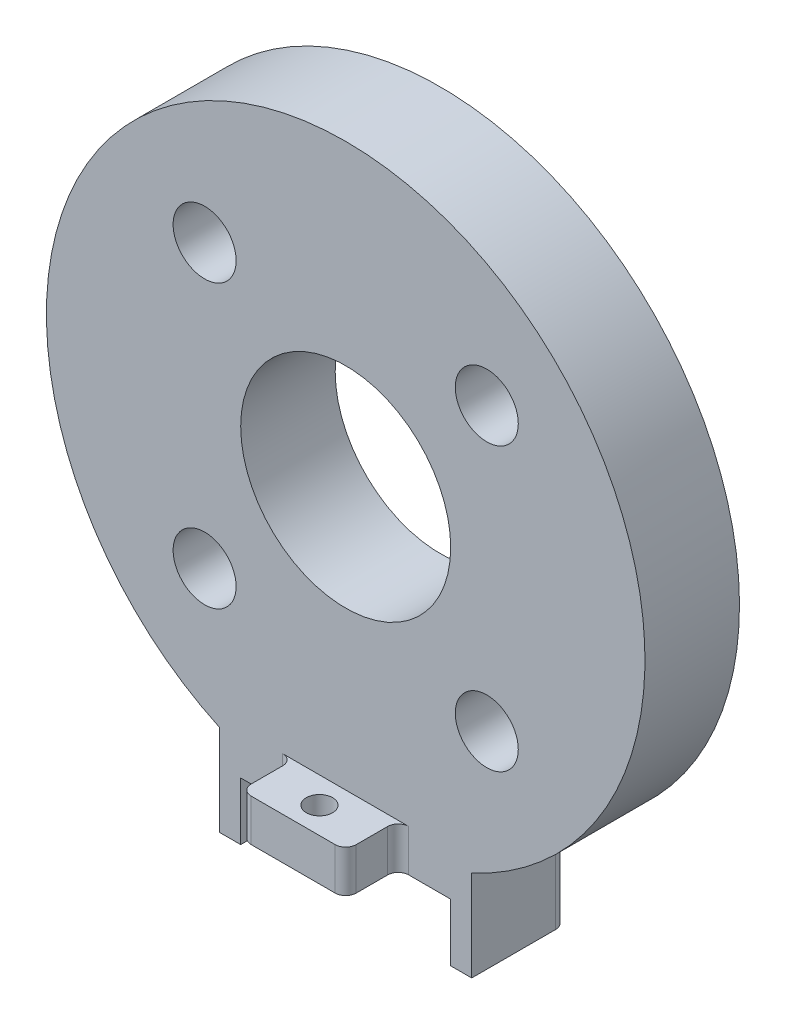
from build123d import *

# Parameters (mm, degrees)
EXTRUDE_1_DEPTH              = 9
SKETCH_2_W                   = 20
SKETCH_2_H                   = 8
CUT_EXTRUDE_1_DEPTH          = 5.5
SKETCH_3_W                   = 10
SKETCH_3_H                   = 4
EXTRUDE_2_DEPTH              = 5
HOLE_WIZARD_20_0_20_1_D      = 20
HOLE_WIZARD_20_0_20_1_DEPTH  = 14
HOLE_WIZARD_2_5_2_5_1_D      = 2.5
HOLE_WIZARD_2_5_2_5_1_DEPTH  = 57.5
HOLE_WIZARD_2_5_2_5_2_D      = 2.5
HOLE_WIZARD_2_5_2_5_2_DEPTH  = 4
HOLE_WIZARD_M3_1_D           = 3.2
HOLE_WIZARD_M3_1_CBORE_D     = 6
HOLE_WIZARD_M3_1_CBORE_DEPTH = 5
FILLET_1_R                   = 0.5
FILLET_2_R                   = 1


with BuildPart() as part:
    # 草图1 → 凸台-拉伸1 (new body)
    with BuildSketch(Plane(origin=(0, 0, 0), x_dir=(-1, 0, 0), z_dir=(0, 0, -1))):
        with BuildLine():
            Line((-12, -25.850531909), (-12, -34.5))
            Line((-12, -34.5), (12, -34.5))
            Line((12, -34.5), (12, -25.850531909))
            ThreePointArc((12, -25.850531909), (0, 28.5), (-12, -25.850531909))
        make_face()
    extrude(amount=-EXTRUDE_1_DEPTH)

    # 草图2 → 切除-拉伸1 (cut)
    with BuildSketch(Plane.XZ.offset(34.5)):
        with Locations((0, 5)):
            Rectangle(SKETCH_2_W, SKETCH_2_H)
    extrude(amount=-CUT_EXTRUDE_1_DEPTH, mode=Mode.SUBTRACT)

    # 草图3 → 凸台-拉伸2 (add)
    with BuildSketch(Plane.XY.offset(9)):
        with Locations((0, -27)):
            Rectangle(SKETCH_3_W, SKETCH_3_H)
    extrude(amount=EXTRUDE_2_DEPTH)

    # Ø20.0 (20) 直径孔1
    with Locations(Plane(origin=(0, 0, 0), x_dir=(-1, 0, 0), z_dir=(0, 0, -1))):
        with Locations((0, 0)):
            Hole(HOLE_WIZARD_20_0_20_1_D / 2, depth=HOLE_WIZARD_20_0_20_1_DEPTH)

    # Ø2.5 (2.5) 直径孔1
    with Locations(Plane.XZ.offset(29)):
        with Locations((0, 11.5)):
            Hole(HOLE_WIZARD_2_5_2_5_1_D / 2, depth=HOLE_WIZARD_2_5_2_5_1_DEPTH)

    # Ø2.5 (2.5) 直径孔2
    with Locations(Plane.XZ.offset(29)):
        with Locations((5.5, 5), (-5.5, 5)):
            Hole(HOLE_WIZARD_2_5_2_5_2_D / 2, depth=HOLE_WIZARD_2_5_2_5_2_DEPTH)

    # M3 六角头机械螺钉的柱形沉头孔1 (through all)
    with Locations(Plane.XY.offset(9)):
        with Locations((-13.435028843, -13.435028843), (-13.435028843, 13.435028843), (13.435028843, 13.435028843), (13.435028843, -13.435028843)):
            CounterBoreHole(HOLE_WIZARD_M3_1_D / 2, HOLE_WIZARD_M3_1_CBORE_D / 2, HOLE_WIZARD_M3_1_CBORE_DEPTH)

    # 圆角1
    fillet_1_edges = [part.edges().sort_by_distance(p)[0] for p in [
        (10, -31.75, 1),
        (-10, -31.75, 1),
    ]]
    fillet(fillet_1_edges, radius=FILLET_1_R)

    # 圆角2
    fillet_2_edges = [part.edges().sort_by_distance(p)[0] for p in [
        (5, -27, 9),
        (-5, -27, 9),
        (5, -27, 14),
        (-5, -27, 14),
        (-12, -30.175265955, 0),
        (12, -30.175265955, 0),
    ]]
    fillet(fillet_2_edges, radius=FILLET_2_R)


solid = part.part
